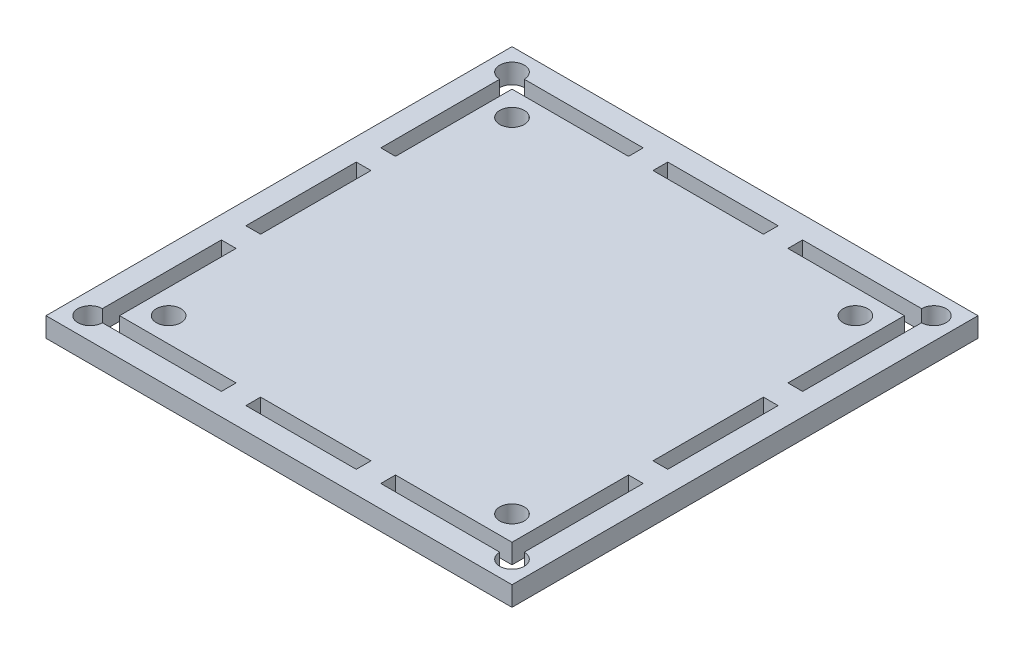
from build123d import *

# Parameters (mm, degrees)
SKETCH1_W           = 38
SKETCH1_H           = 38
SKETCH1_R           = 1
SKETCH1_W_2         = 9
SKETCH1_H_2         = 1.2
SKETCH1_W_3         = 1.2
SKETCH1_H_3         = 9
BOSS_EXTRUDE1_DEPTH = 1.6


with BuildPart() as part:
    # Sketch1 → Boss-Extrude1 (new body)
    with BuildSketch(Plane.XZ):
        Rectangle(SKETCH1_W, SKETCH1_H)
        with Locations(Location((-14, -14, 0), (0, 0, 90))):
            Circle(SKETCH1_R, mode=Mode.SUBTRACT)
        with Locations(Location((-14, 14, 0), (0, 0, 90))):
            Circle(SKETCH1_R, mode=Mode.SUBTRACT)
        with Locations(Location((14, -14, 0), (0, 0, 90))):
            Circle(SKETCH1_R, mode=Mode.SUBTRACT)
        with Locations(Location((14, 14, 0), (0, 0, 90))):
            Circle(SKETCH1_R, mode=Mode.SUBTRACT)
        with BuildLine():
            Line((6.5, 17.2), (16.2, 17.2))
            ThreePointArc((16.2, 17.2), (17.907106781, 17.907106781), (17.2, 16.2))
            Line((17.2, 16.2), (17.2, 6.5))
            Line((17.2, 6.5), (16, 6.5))
            Line((16, 6.5), (16, 16))
            Line((16, 16), (6.5, 16))
            Line((6.5, 16), (6.5, 17.2))
        make_face(mode=Mode.SUBTRACT)
        with BuildLine():
            Line((-6.5, -17.2), (-16.2, -17.2))
            ThreePointArc((-16.2, -17.2), (-17.907106781, -17.907106781), (-17.2, -16.2))
            Line((-17.2, -16.2), (-17.2, -6.5))
            Line((-17.2, -6.5), (-16, -6.5))
            Line((-16, -6.5), (-16, -16))
            Line((-16, -16), (-6.5, -16))
            Line((-6.5, -16), (-6.5, -17.2))
        make_face(mode=Mode.SUBTRACT)
        with Locations((0, 16.6)):
            Rectangle(SKETCH1_W_2, SKETCH1_H_2, mode=Mode.SUBTRACT)
        with BuildLine():
            Line((6.5, -16), (16, -16))
            Line((16, -16), (16, -6.5))
            Line((16, -6.5), (17.2, -6.5))
            Line((17.2, -6.5), (17.2, -16.2))
            ThreePointArc((17.2, -16.2), (17.907106781, -17.907106781), (16.2, -17.2))
            Line((16.2, -17.2), (6.5, -17.2))
            Line((6.5, -17.2), (6.5, -16))
        make_face(mode=Mode.SUBTRACT)
        with Locations((-16.6, 0)):
            Rectangle(SKETCH1_W_3, SKETCH1_H_3, mode=Mode.SUBTRACT)
        with Locations((16.6, 0)):
            Rectangle(SKETCH1_W_3, SKETCH1_H_3, mode=Mode.SUBTRACT)
        with BuildLine():
            Line((-16, 16), (-16, 6.5))
            Line((-16, 6.5), (-17.2, 6.5))
            Line((-17.2, 6.5), (-17.2, 16.2))
            ThreePointArc((-17.2, 16.2), (-17.907106781, 17.907106781), (-16.2, 17.2))
            Line((-16.2, 17.2), (-6.5, 17.2))
            Line((-6.5, 17.2), (-6.5, 16))
            Line((-6.5, 16), (-16, 16))
        make_face(mode=Mode.SUBTRACT)
        with Locations((0, -16.6)):
            Rectangle(SKETCH1_W_2, SKETCH1_H_2, mode=Mode.SUBTRACT)
    extrude(amount=-BOSS_EXTRUDE1_DEPTH)


solid = part.part
